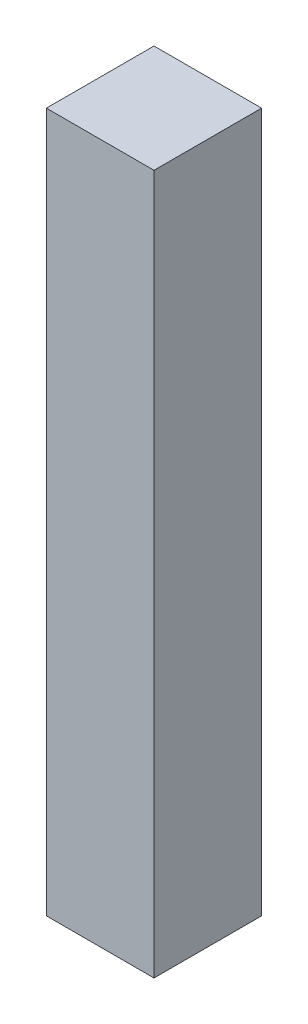
from build123d import *

# Parameters (mm, degrees)
CROQUIS1_W              = 5
CROQUIS1_H              = 5
SALIENTE_EXTRUIR1_DEPTH = 16.25


with BuildPart() as part:
    # Croquis1 → Saliente-Extruir1 (new, symmetric)
    with BuildSketch(Plane(origin=(0, 0, 0), x_dir=(1, 0, 0), z_dir=(0, 1, 0))):
        Rectangle(CROQUIS1_W, CROQUIS1_H)
    extrude(amount=SALIENTE_EXTRUIR1_DEPTH, both=True)


solid = part.part
